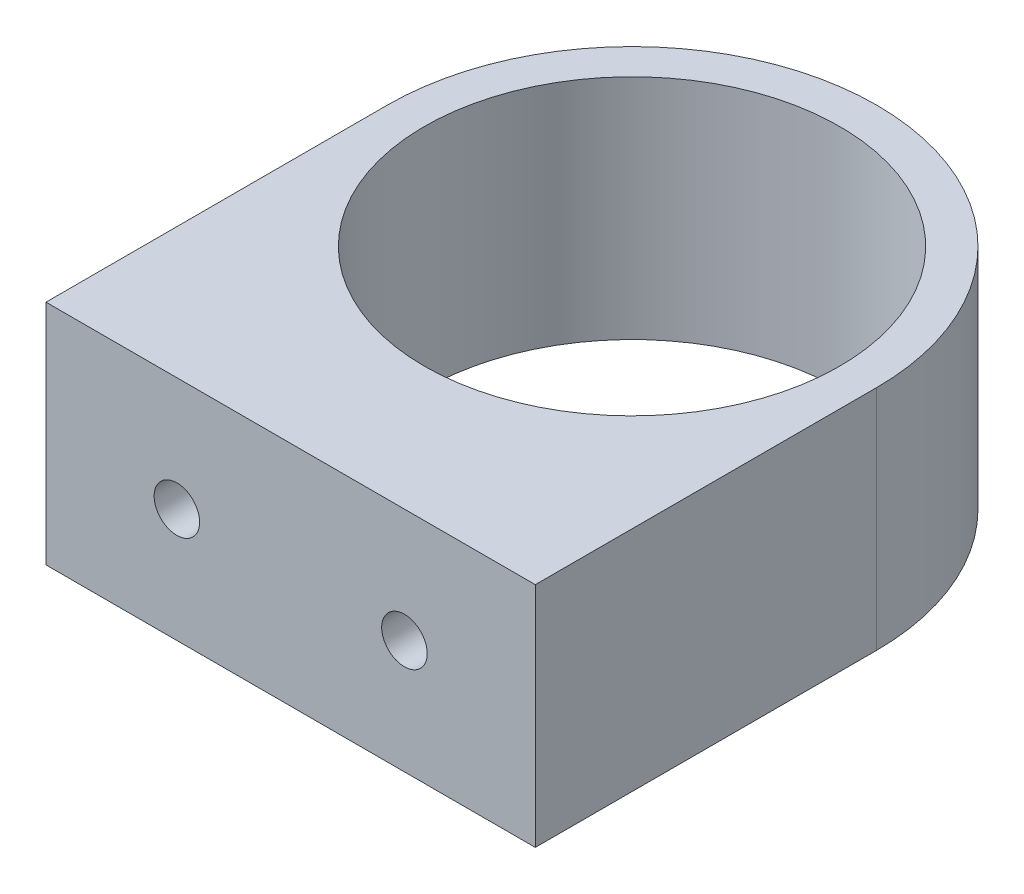
from build123d import *

# Parameters (mm, degrees)
SKETCH1_R           = 21.5
SKETCH1_R_2         = 18.25
BOSS_EXTRUDE1_DEPTH = 20
SKETCH2_R           = 2
CUT_EXTRUDE1_DEPTH  = 10


with BuildPart() as part:
    # Sketch1 → Boss-Extrude1 (new body)
    # profile 1 of 2: a face of its own
    with BuildSketch(Plane(origin=(0, 0, 0), x_dir=(1, 0, 0), z_dir=(0, 1, 0))):
        with BuildLine():
            ThreePointArc((21.5, 0), (0, -21.5), (-21.5, 0))
            Line((-21.5, 0), (-21.5, -30))
            Line((-21.5, -30), (21.5, -30))
            Line((21.5, -30), (21.5, 0))
        make_face()
    # profile 2 of 2: a face of its own
    with BuildSketch(Plane(origin=(0, 0, 0), x_dir=(1, 0, 0), z_dir=(0, 1, 0))):
        Circle(SKETCH1_R)
        with Locations(Location((0, 0, 0), (0, 0, 270))):
            Circle(SKETCH1_R_2, mode=Mode.SUBTRACT)
    extrude(amount=BOSS_EXTRUDE1_DEPTH)

    # Sketch2 → Cut-Extrude1 (cut)
    with BuildSketch(Plane.XY.offset(30)):
        with Locations((-10, 10)):
            Circle(SKETCH2_R)
        with Locations((10, 10)):
            Circle(SKETCH2_R)
    extrude(amount=-CUT_EXTRUDE1_DEPTH, mode=Mode.SUBTRACT)


solid = part.part
